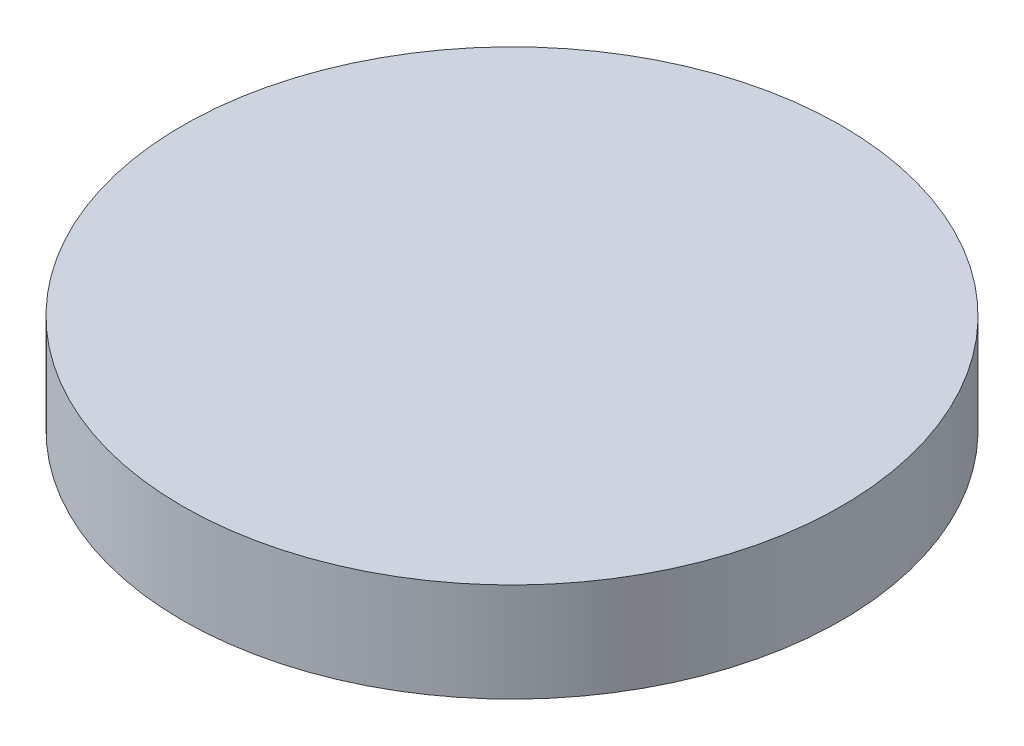
from build123d import *

# Parameters (mm, degrees)
SKETCH1_R           = 25.4
BOSS_EXTRUDE2_DEPTH = 7.62
SKETCH4_R           = 4.826
CUT_EXTRUDE2_DEPTH  = 6.096
CIRPATTERN1_COUNT   = 6
SKETCH5_R           = 4.826
CUT_EXTRUDE6_DEPTH  = 6.096
SCALE1_SCALE        = 0.5


with BuildPart() as part:
    # Sketch1 → Boss-Extrude2 (new body)
    with BuildSketch(Plane(origin=(0, 0, 0), x_dir=(1, 0, 0), z_dir=(0, 1, 0))):
        with Locations(Location((0, 0, 0), (0, 0, 270))):
            Circle(SKETCH1_R)
    extrude(amount=BOSS_EXTRUDE2_DEPTH)

    # Sketch4 → Cut-Extrude2 (cut)
    with BuildSketch(Plane(origin=(0, 0, 0), x_dir=(1, 0, 0), z_dir=(0, 1, 0))):
        with Locations(Location((0, 17.78, 0), (0, 0, 90))):
            Circle(SKETCH4_R)
    cut_extrude2 = extrude(amount=CUT_EXTRUDE2_DEPTH, mode=Mode.SUBTRACT)

    # CirPattern1: Cut-Extrude2 ×6 about axis
    cirpattern1_axis = Axis((0, 0, 0), (0, 1, 0))
    for i in range(1, CIRPATTERN1_COUNT):
        add(cut_extrude2.rotate(cirpattern1_axis, i * 360 / CIRPATTERN1_COUNT), mode=Mode.SUBTRACT)

    # Sketch5 → Cut-Extrude6 (cut)
    with BuildSketch(Plane(origin=(0, 0, 0), x_dir=(1, 0, 0), z_dir=(0, 1, 0))):
        with Locations(Location((0, 0, 0), (0, 0, 90))):
            Circle(SKETCH5_R)
    extrude(amount=CUT_EXTRUDE6_DEPTH, mode=Mode.SUBTRACT)


with BuildPart() as part_1:
    # Scale1: scaled about (0, 4.003078713, 0)
    add(part.part.scale(SCALE1_SCALE).moved(Location((0, 2.001539356, 0))))


solid = part_1.part
